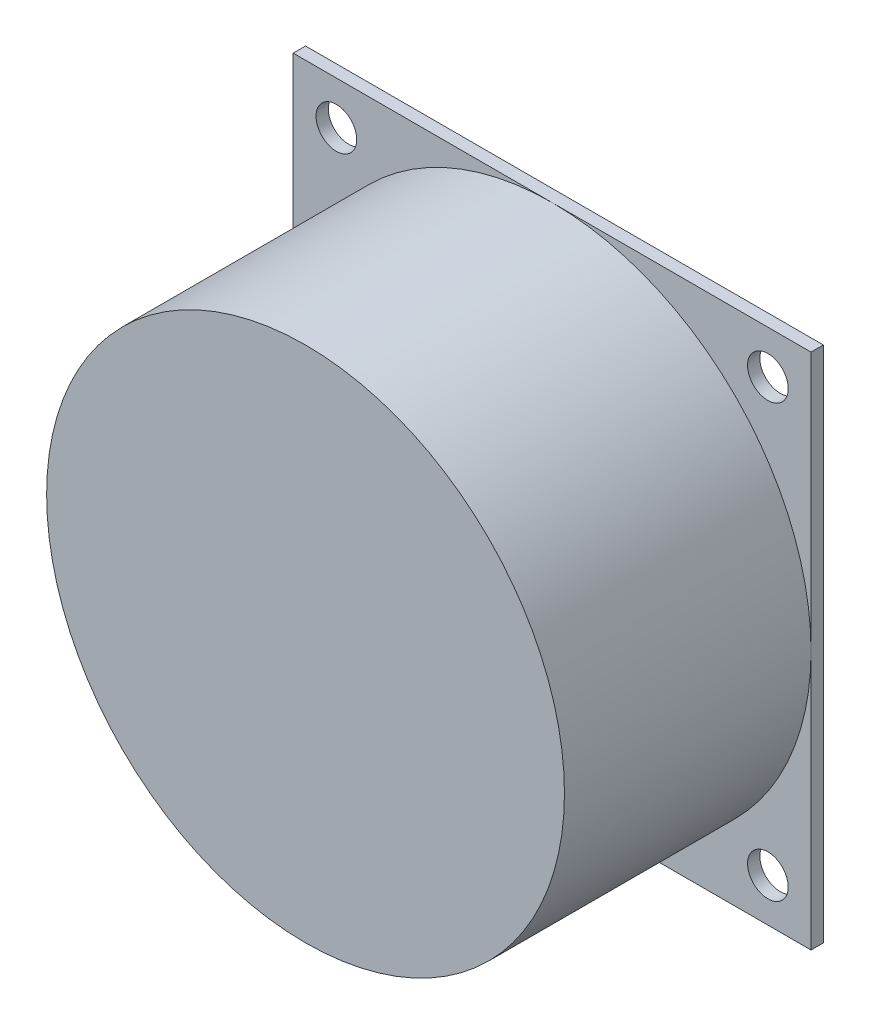
from build123d import *

# Parameters (mm, degrees)
SKETCH1_W           = 42
SKETCH1_H           = 42
SKETCH1_R           = 1.65
BOSS_EXTRUDE1_DEPTH = 1
SKETCH2_R           = 21
BOSS_EXTRUDE2_DEPTH = 20
SKETCH3_R           = 5
BOSS_EXTRUDE3_DEPTH = 10


with BuildPart() as part:
    # Sketch1 → Boss-Extrude1 (new body)
    with BuildSketch(Plane.XY):
        Rectangle(SKETCH1_W, SKETCH1_H)
        with Locations((-17.5, 17.5)):
            Circle(SKETCH1_R, mode=Mode.SUBTRACT)
        with Locations((17.5, 17.5)):
            Circle(SKETCH1_R, mode=Mode.SUBTRACT)
        with Locations((17.5, -17.5)):
            Circle(SKETCH1_R, mode=Mode.SUBTRACT)
        with Locations((-17.5, -17.5)):
            Circle(SKETCH1_R, mode=Mode.SUBTRACT)
    extrude(amount=BOSS_EXTRUDE1_DEPTH)

    # Sketch2 → Boss-Extrude2 (add)
    with BuildSketch(Plane.XY.offset(1)):
        Circle(SKETCH2_R)
    extrude(amount=BOSS_EXTRUDE2_DEPTH)

    # Sketch3 → Boss-Extrude3 (add)
    with BuildSketch(Plane(origin=(0, 0, 0), x_dir=(-1, 0, 0), z_dir=(0, 0, -1))):
        Circle(SKETCH3_R)
    extrude(amount=BOSS_EXTRUDE3_DEPTH)


solid = part.part
